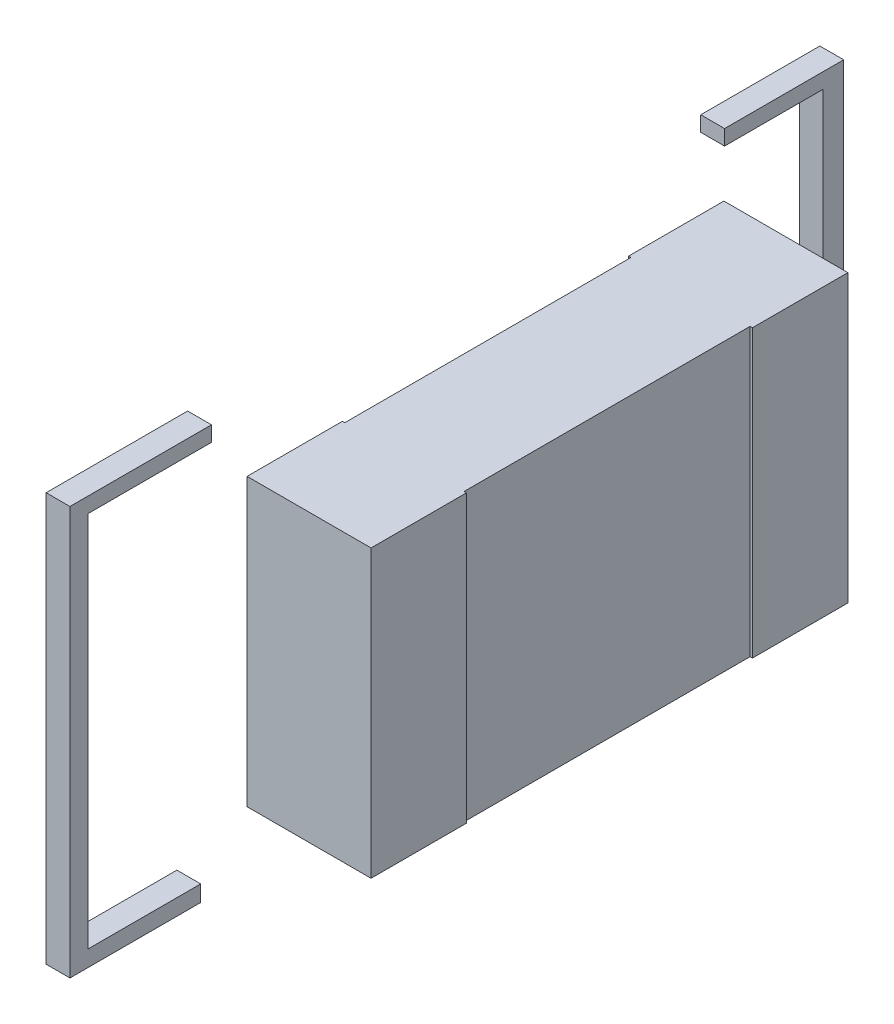
from build123d import *

# Parameters (mm, degrees)
SKETCH_1_W        = 1.2
SKETCH_1_H        = 1.2
EXTRUDE_1_DEPTH   = 0.5
SKETCH_2_W        = 0.52
SKETCH_2_H        = 1.2
EXTRUDE_3_DEPTH   = 0.4
EXTRUDE_4_DEPTH   = 0.1
EXTRUDE_4_2_DEPTH = 0.1


with BuildPart() as part:
    # 草图1 → 凸台-拉伸1 (new body)
    with BuildSketch(Plane(origin=(0, 0, 0), x_dir=(0, 0, -1), z_dir=(1, 0, 0))):
        with Locations((0.6, -0.6)):
            Rectangle(SKETCH_1_W, SKETCH_1_H)
    extrude(amount=EXTRUDE_1_DEPTH)

    # 草图2 → 凸台-拉伸3 (add)
    with BuildSketch(Plane.XY):
        with Locations((0.25, -0.6)):
            Rectangle(SKETCH_2_W, SKETCH_2_H)
    extrude_3 = extrude(amount=EXTRUDE_3_DEPTH)

    # 镜向1: 凸台-拉伸3 across plane
    add(extrude_3.mirror(Plane.XY.offset(-0.6)))


with BuildPart() as body_2:
    # 草图3 → 凸台-拉伸4 (new body)
    with BuildSketch(Plane.ZY.offset(0.01)):
        Polygon((-1.602882837, 0.262028506), (-1.602882837, 0.198174543), (-2.016055542, 0.198174543), (-2.016055542, -1.383150081), (-1.602882837, -1.383150081), (-1.602882837, -1.45076016), (-2.102446198, -1.45076016), (-2.102446198, 0.262028506), align=None)
    extrude(amount=EXTRUDE_4_DEPTH)


with BuildPart() as body_3:
    # 草图3 → Extrude 4 2 (new body)
    with BuildSketch(Plane.ZY.offset(0.01)):
        Polygon((1.14283759, 0.262028506), (1.14283759, -1.45076016), (0.594444728, -1.45076016), (0.594444728, -1.383150081), (1.06771528, -1.383150081), (1.06771528, 0.198174543), (0.549371342, 0.198174543), (0.549371342, 0.262028506), align=None)
    extrude(amount=EXTRUDE_4_2_DEPTH)


solid = Compound([part.part, body_2.part, body_3.part])
